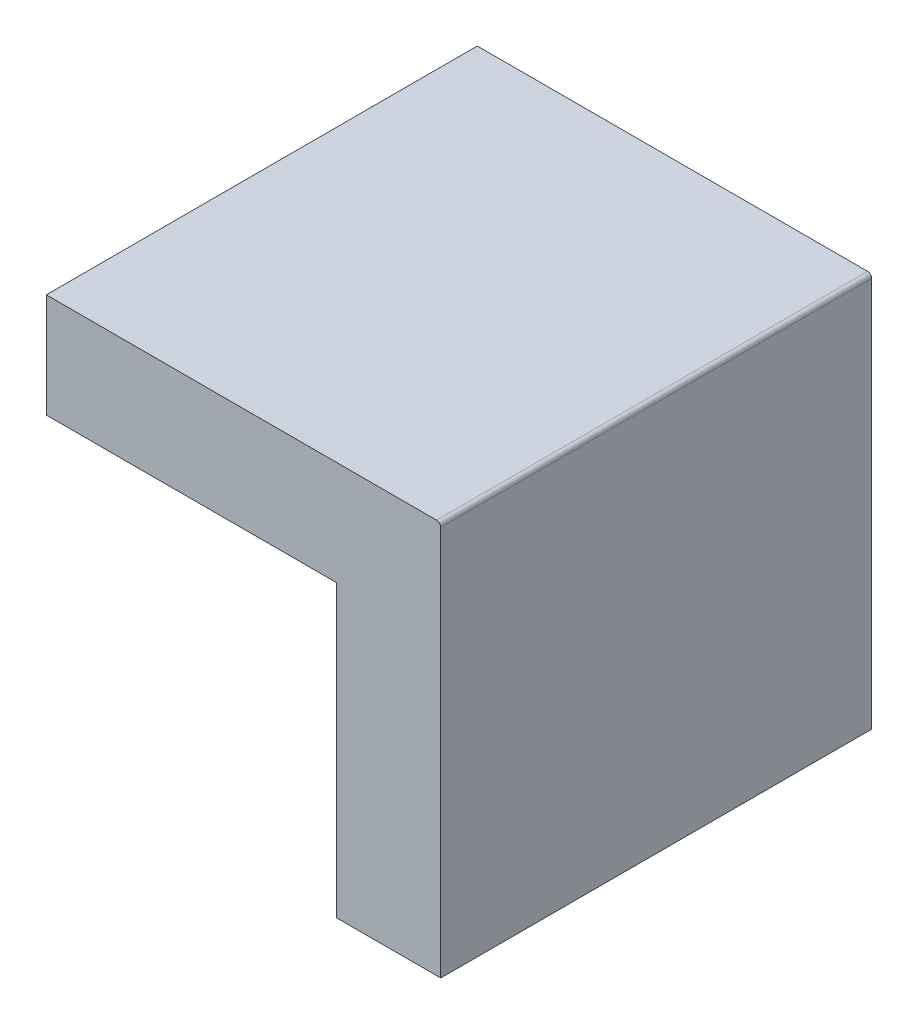
from build123d import *

# Parameters (mm, degrees)
BOSS_EXTRUDE2_DEPTH      = 304.8
BOSS_EXTRUDE2_DEPTH_BACK = 704.8


with BuildPart() as part:
    # Sketch1 → Boss-Extrude2 (new, two sides: drawn at the far end of the back side and taken through both)
    with BuildSketch(Plane.XY.offset(-BOSS_EXTRUDE2_DEPTH_BACK)):
        with BuildLine():
            Line((0, -9.525), (0, -923.925))
            Line((0, -923.925), (-243.93812726, -923.925))
            Line((-243.93812726, -923.925), (-243.93812726, -243.93812726))
            Line((-243.93812726, -243.93812726), (-923.925, -243.93812726))
            Line((-923.925, -243.93812726), (-923.925, 0))
            Line((-923.925, 0), (-9.525, 0))
            ThreePointArc((-9.525, 0), (-2.789807909, -2.789807909), (0, -9.525))
        make_face()
    extrude(amount=BOSS_EXTRUDE2_DEPTH + BOSS_EXTRUDE2_DEPTH_BACK)


solid = part.part
